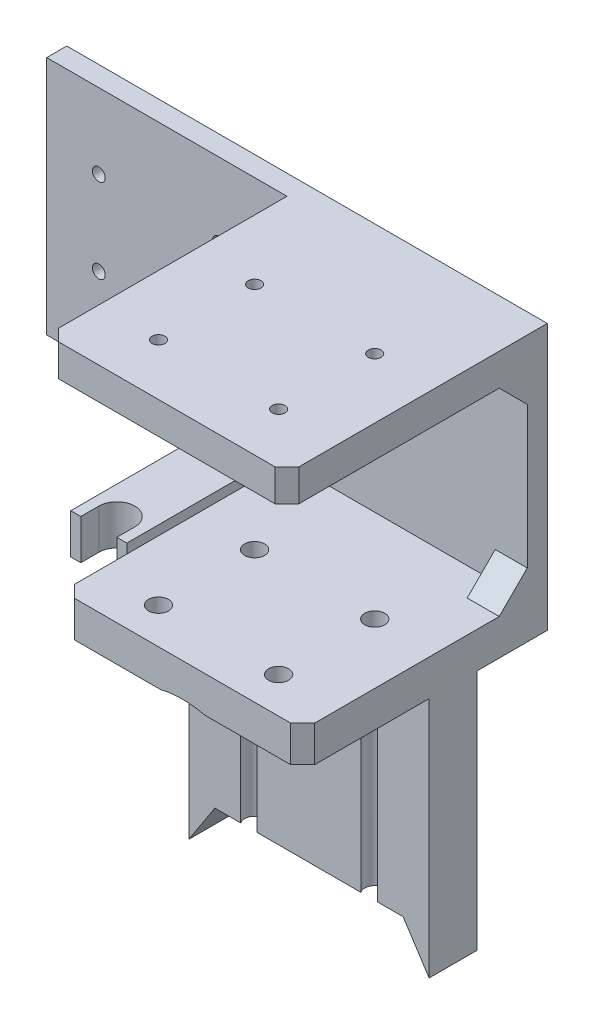
from build123d import *

# Parameters (mm, degrees)
SKETCH_1_W               = 120
SKETCH_1_H               = 60
EXTRUDE_1_DEPTH          = 5
SKETCH_3_W               = 60
SKETCH_3_H               = 8
EXTRUDE_3_DEPTH          = 60
SKETCH_4_W               = 61.088110118
SKETCH_4_H               = 9
EXTRUDE_4_DEPTH          = 60
SKETCH_6_R               = 23.5
CUT_EXTRUDE_1_DEPTH      = 134.603892159
EXTRUDE_5_DEPTH          = 50
SKETCH_8_W               = 20.5
SKETCH_8_H               = 60.427303984
SKETCH_8_W_2             = 17.5
CUT_EXTRUDE_2_DEPTH      = 60
EXTRUDE_6_DEPTH          = 10
SKETCH_11_R              = 1.6
CUT_EXTRUDE_3_DEPTH      = 160.893337757
SKETCH_12_R              = 1.6
CUT_EXTRUDE_4_DEPTH      = 134.603892159
RIB_1_REACH              = 160.193
SKETCH_13_WALL_W         = 328.285335328
SKETCH_13_WALL_H         = 8
MIRROR_2_COPY_1_REACH    = 160.193
MIRROR_2_COPY_1_SKETCH_W = 328.285335328
MIRROR_2_COPY_1_SKETCH_H = 8
SKETCH_15_W              = 5
SKETCH_15_H              = 6.382962656
EXTRUDE_7_DEPTH          = 10
CHAMFER_2_SIZE           = 2
CHAMFER_3_SIZE           = 3
SKETCH_16_R              = 2.5
CUT_EXTRUDE_5_DEPTH      = 128.554500267
SKETCH_18_R              = 3.75
CUT_EXTRUDE_7_DEPTH      = 2


with BuildPart() as part:
    # 草图1 → 凸台-拉伸1 (new body)
    with BuildSketch(Plane.XY):
        with Locations((-25, 50)):
            Rectangle(SKETCH_1_W, SKETCH_1_H)
    extrude(amount=EXTRUDE_1_DEPTH)

    # 草图3 → 凸台-拉伸3 (add)
    with BuildSketch(Plane.XY.offset(5)):
        with Locations((5, 76)):
            Rectangle(SKETCH_3_W, SKETCH_3_H)
    extrude(amount=EXTRUDE_3_DEPTH)

    # 草图4 → 凸台-拉伸4 (add)
    with BuildSketch(Plane(origin=(35, 0, 0), x_dir=(0, 0, -1), z_dir=(1, 0, 0))):
        with Locations((-30.544055059, 18.117037344)):
            Rectangle(SKETCH_4_W, SKETCH_4_H)
    extrude(amount=-EXTRUDE_4_DEPTH)

    # 草图6 → 切除-拉伸1 (cut, through all)
    with BuildSketch(Plane(origin=(0, 0, 0), x_dir=(-1, 0, 0), z_dir=(0, 0, -1))):
        with Locations((-5, -9.213883343)):
            Circle(SKETCH_6_R)
    extrude(amount=-CUT_EXTRUDE_1_DEPTH, mode=Mode.SUBTRACT)

    # 草图7 → 凸台-拉伸5 (add)
    with BuildSketch(Plane(origin=(0, 0, 0), x_dir=(-1, 0, 0), z_dir=(0, 0, -1))):
        with BuildLine():
            Line((25, 13.617037344), (-35, 13.617037344))
            Line((-35, 13.617037344), (-35, -46.81026664))
            Line((-35, -46.81026664), (-28.815961295, -37.29636094))
            ThreePointArc((-28.815961295, -37.29636094), (-28.684669265, -37.061070002), (-28.586195427, -36.81026664))
            Line((-28.586195427, -36.81026664), (18.586195427, -36.81026664))
            ThreePointArc((18.586195427, -36.81026664), (18.684669265, -37.061070002), (18.815961295, -37.29636094))
            Line((18.815961295, -37.29636094), (25, -46.81026664))
            Line((25, -46.81026664), (25, 13.617037344))
        make_face()
    extrude(amount=-EXTRUDE_5_DEPTH)

    # 草图8 → 切除-拉伸2 (cut)
    with BuildSketch(Plane(origin=(35, 0, 0), x_dir=(0, 0, -1), z_dir=(1, 0, 0))):
        with Locations((-39.75, -16.596614648)):
            Rectangle(SKETCH_8_W, SKETCH_8_H)
        with Locations((-8.75, -16.596614648)):
            Rectangle(SKETCH_8_W_2, SKETCH_8_H)
    extrude(amount=-CUT_EXTRUDE_2_DEPTH, mode=Mode.SUBTRACT)

    # 草图9 → 凸台-拉伸6 (add)
    with BuildSketch(Plane.XZ.offset(-20)):
        with BuildLine():
            Line((-32.5, 0), (-41.5, 0))
            Line((-41.5, 0), (-44, 0))
            Line((-44, 0), (-44, 40))
            Line((-44, 40), (-41.5, 40))
            Line((-41.5, 40), (-41.5, 35.5))
            ThreePointArc((-41.5, 35.5), (-37, 31), (-32.5, 35.5))
            Line((-32.5, 35.5), (-32.5, 40))
            Line((-32.5, 40), (-30, 40))
            Line((-30, 40), (-30, 0))
            Line((-30, 0), (-32.5, 0))
        make_face()
    extrude(amount=EXTRUDE_6_DEPTH)

    # 草图11 → 切除-拉伸3 (cut, through all)
    with BuildSketch(Plane(origin=(0, 72, 0), x_dir=(-1, 0, 0), z_dir=(0, -1, 0))):
        with Locations(Location((-20, -52.088110118, 0), (0, 0, 90))):
            Circle(SKETCH_11_R)
        with Locations(Location((10, -28.088110118, 0), (0, 0, 90))):
            Circle(SKETCH_11_R)
        with Locations(Location((-20, -28.088110118, 0), (0, 0, 90))):
            Circle(SKETCH_11_R)
        with Locations(Location((10, -52.088110118, 0), (0, 0, 90))):
            Circle(SKETCH_11_R)
    extrude(amount=-CUT_EXTRUDE_3_DEPTH, mode=Mode.SUBTRACT)

    # 草图12 → 切除-拉伸4 (cut, through all)
    with BuildSketch(Plane(origin=(0, 0, 0), x_dir=(-1, 0, 0), z_dir=(0, 0, -1))):
        with Locations((42, 40.25)):
            Circle(SKETCH_12_R)
        with Locations((42, 61.25)):
            Circle(SKETCH_12_R)
        with Locations((72, 40.25)):
            Circle(SKETCH_12_R)
        with Locations((72, 61.25)):
            Circle(SKETCH_12_R)
    extrude(amount=-CUT_EXTRUDE_4_DEPTH, mode=Mode.SUBTRACT)

    # 草图13 wall → 筋1 (add, up to next)
    with BuildSketch(Plane(origin=(35, 68.5, 8.5), x_dir=(0, 0.707106781187, 0.707106781187), z_dir=(0, -0.707106781187, 0.707106781187)), mode=Mode.PRIVATE) as rib_1_sk1:
        with Locations((0, 4)):
            Rectangle(SKETCH_13_WALL_W, SKETCH_13_WALL_H)
    rib_1_tool1 = extrude(rib_1_sk1.sketch, amount=-RIB_1_REACH, mode=Mode.PRIVATE) - part.part
    rib_1 = rib_1_tool1.solids().sort_by_distance((35, 68.5, 8.5))[0]
    add(rib_1)

    # 镜向1: 筋1 across plane
    add(rib_1.mirror(Plane(origin=(5, 0, 0), x_dir=(0, 0, 1), z_dir=(1, 0, 0))))

    # 镜向2: 筋1 across plane
    add(rib_1.mirror(Plane(origin=(0, 47.308518672, 0), x_dir=(0, 0, 1), z_dir=(0, -1, 0))))

    # 镜向2 copy 1 sketch → 镜向2 copy 1 (add, up to next)
    with BuildSketch(Plane(origin=(-25, 26.117037344, 8.5), x_dir=(0, -0.7071067811870001, 0.7071067811869999), z_dir=(0, 0.7071067811869999, 0.7071067811870001)), mode=Mode.PRIVATE) as mirror_2_copy_1_sk1:
        with Locations((0, 4)):
            Rectangle(MIRROR_2_COPY_1_SKETCH_W, MIRROR_2_COPY_1_SKETCH_H)
    mirror_2_copy_1_tool1 = extrude(mirror_2_copy_1_sk1.sketch, amount=-MIRROR_2_COPY_1_REACH, mode=Mode.PRIVATE) - part.part
    add(mirror_2_copy_1_tool1.solids().sort_by_distance((-25, 26.117037344, 8.5))[0])

    # 草图15 → 凸台-拉伸7 (add)
    with BuildSketch(Plane(origin=(0, 0, 0), x_dir=(-1, 0, 0), z_dir=(0, 0, -1))):
        with Locations((27.5, 16.808518672)):
            Rectangle(SKETCH_15_W, SKETCH_15_H)
        with Locations((46.5, 16.808518672)):
            Rectangle(SKETCH_15_W, SKETCH_15_H)
    extrude(amount=-EXTRUDE_7_DEPTH)

    # 倒角2
    chamfer_2_edges = [part.edges().sort_by_distance(p)[0] for p in [
        (-49, 16.808518672, 10),
    ]]
    chamfer(chamfer_2_edges, length=CHAMFER_2_SIZE)

    # 倒角3
    chamfer_3_edges = [part.edges().sort_by_distance(p)[0] for p in [
        (-25, 76, 65),
        (35, 76, 65),
        (35, 18.117037344, 61.088110118),
        (-25, 18.117037344, 61.088110118),
    ]]
    chamfer(chamfer_3_edges, length=CHAMFER_3_SIZE)

    # 草图16 → 切除-拉伸5 (cut, through all)
    with BuildSketch(Plane(origin=(0, 22.617037344, 0), x_dir=(1, 0, 0), z_dir=(0, 1, 0))):
        with Locations(Location((20, -52.088110118, 0), (0, 0, 180))):
            Circle(SKETCH_16_R)
        with Locations(Location((-10, -52.088110118, 0), (0, 0, 180))):
            Circle(SKETCH_16_R)
        with Locations(Location((-10, -28.088110118, 0), (0, 0, 180))):
            Circle(SKETCH_16_R)
        with Locations(Location((20, -28.088110118, 0), (0, 0, 180))):
            Circle(SKETCH_16_R)
    extrude(amount=-CUT_EXTRUDE_5_DEPTH, mode=Mode.SUBTRACT)

    # 草图18 → 切除-拉伸7 (cut)
    with BuildSketch(Plane(origin=(0, 0, 0), x_dir=(-1, 0, 0), z_dir=(0, 0, -1))):
        with Locations((75, 75)):
            Circle(SKETCH_18_R)
        with Locations((25, 75)):
            Circle(SKETCH_18_R)
        with Locations((-25, 75)):
            Circle(SKETCH_18_R)
        with Locations((-25, 25)):
            Circle(SKETCH_18_R)
        with Locations((25, 25)):
            Circle(SKETCH_18_R)
        with Locations((75, 25)):
            Circle(SKETCH_18_R)
    extrude(amount=-CUT_EXTRUDE_7_DEPTH, mode=Mode.SUBTRACT)


solid = part.part
